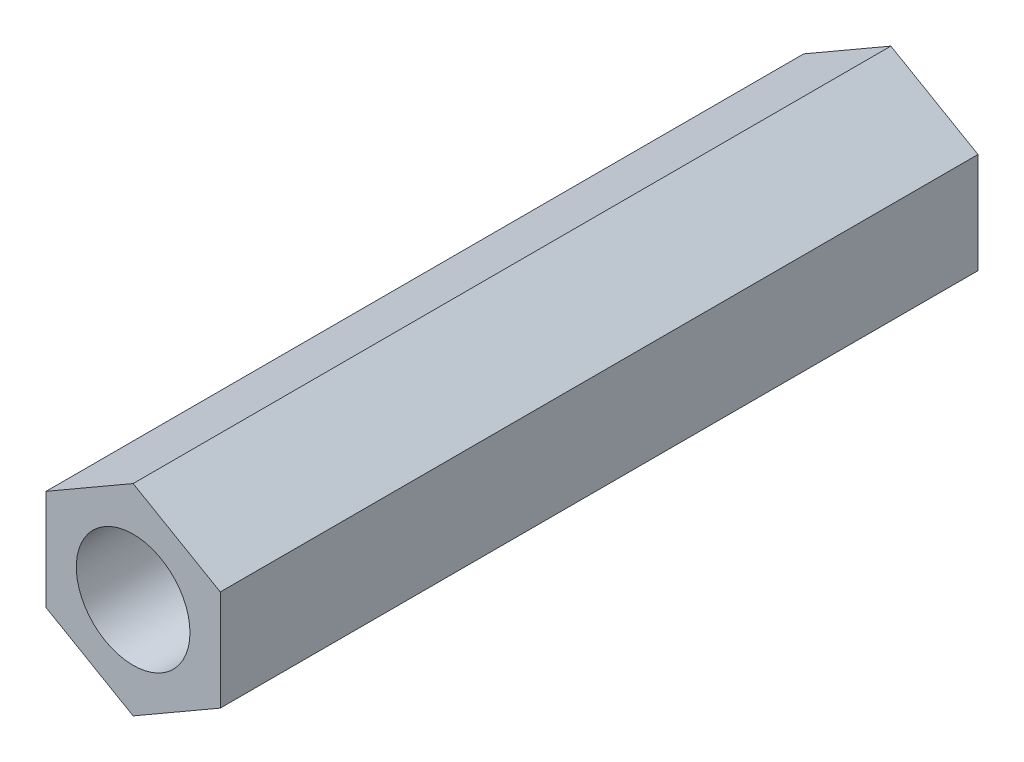
from build123d import *

# Parameters (mm, degrees)
SKETCH_1_R      = 1.5
EXTRUDE_1_DEPTH = 20


with BuildPart() as part:
    # 草图1 → 凸台-拉伸1 (new body)
    with BuildSketch(Plane.XY):
        Polygon((2.3, 1.327905619), (0, 2.655811238), (-2.3, 1.327905619), (-2.3, -1.327905619), (0, -2.655811238), (2.3, -1.327905619), align=None)
        Circle(SKETCH_1_R, mode=Mode.SUBTRACT)
    extrude(amount=EXTRUDE_1_DEPTH)


solid = part.part
